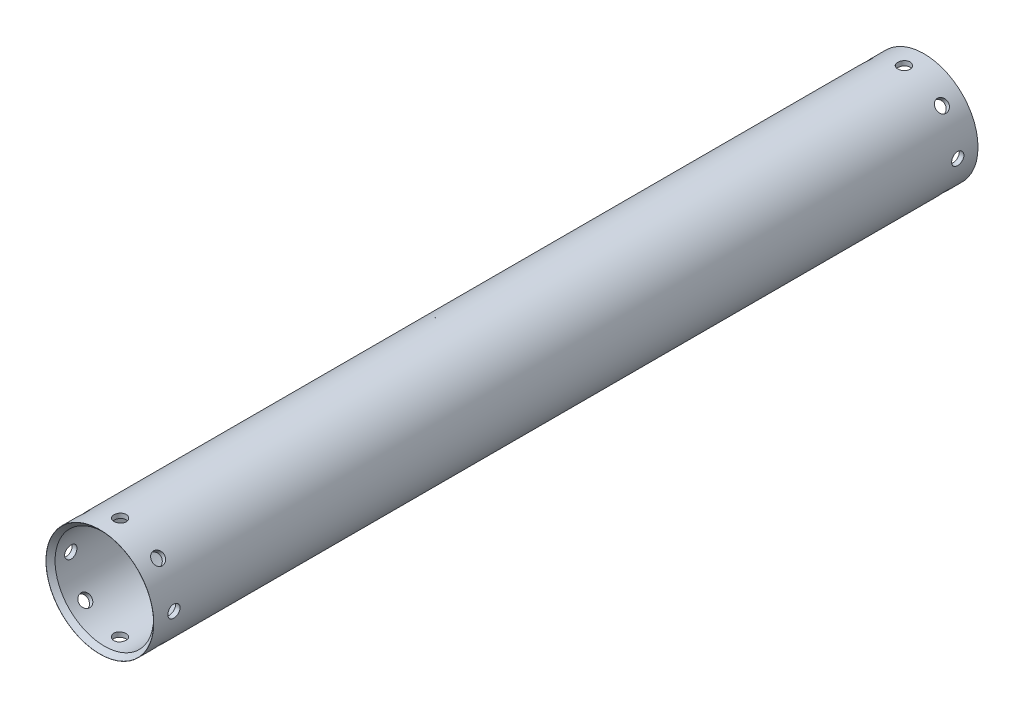
from build123d import *

# Parameters (mm, degrees)
SKETCH1_R               = 38.275
BOSS_EXTRUDE1_DEPTH     = 585
SKETCH2_R               = 34.975
CUT_EXTRUDE1_DEPTH      = 585
CUT_EXTRUDE2_DEPTH      = 588.49889468
CUT_EXTRUDE2_DEPTH_BACK = 588.49889468
SKETCH6_R               = 4.35
CUT_EXTRUDE3_DEPTH      = 588.498894792
CUT_EXTRUDE3_DEPTH_BACK = 588.498894792
SKETCH7_R               = 4.35
CUT_EXTRUDE4_DEPTH      = 588.498894792
CUT_EXTRUDE4_DEPTH_BACK = 588.498894792
SKETCH8_R               = 4.35
CUT_EXTRUDE5_DEPTH      = 588.498894792
CUT_EXTRUDE5_DEPTH_BACK = 588.498894792
SKETCH9_R               = 4.35
CUT_EXTRUDE6_DEPTH      = 593.25290528
CUT_EXTRUDE6_DEPTH_BACK = 593.25290528
SKETCH10_R              = 4.35
CUT_EXTRUDE7_DEPTH      = 593.25290528
CUT_EXTRUDE7_DEPTH_BACK = 593.25290528
SKETCH11_R              = 4.35
CUT_EXTRUDE8_DEPTH      = 585
CUT_EXTRUDE8_DEPTH_BACK = 585
SKETCH12_R              = 4.35
CUT_EXTRUDE9_DEPTH      = 585
CUT_EXTRUDE9_DEPTH_BACK = 585
SKETCH13_R              = 4.35
CHAMFER1_SIZE           = 3.2
CHAMFER2_SIZE           = 3.2


with BuildPart() as part:
    # Sketch1 → Boss-Extrude1 (new body)
    with BuildSketch(Plane.XY):
        Circle(SKETCH1_R)
    extrude(amount=BOSS_EXTRUDE1_DEPTH)

    # Sketch2 → Cut-Extrude1 (cut)
    with BuildSketch(Plane.XY.offset(585)):
        Circle(SKETCH2_R)
    extrude(amount=-CUT_EXTRUDE1_DEPTH, mode=Mode.SUBTRACT)

    # Sketch6 → Cut-Extrude2 (cut, two sides: drawn at the far end of the back side and taken through both)
    with BuildSketch(Plane(origin=(0, 0, 0), x_dir=(1, 0, 0), z_dir=(0, 1, 0)).offset(-CUT_EXTRUDE2_DEPTH_BACK)):
        with Locations(Location((0, -570.65, 0), (0, 0, 270))):
            Circle(SKETCH6_R)
    extrude(amount=CUT_EXTRUDE2_DEPTH + CUT_EXTRUDE2_DEPTH_BACK, mode=Mode.SUBTRACT)

    # Sketch7 → Cut-Extrude3 (cut, two sides: drawn at the far end of the back side and taken through both)
    with BuildSketch(Plane(origin=(0, 0, 0), x_dir=(0, 0, -1), z_dir=(1, 0, 0)).offset(-CUT_EXTRUDE3_DEPTH_BACK)):
        with Locations((-570.65, 0)):
            Circle(SKETCH7_R)
    extrude(amount=CUT_EXTRUDE3_DEPTH + CUT_EXTRUDE3_DEPTH_BACK, mode=Mode.SUBTRACT)

    # Sketch8 → Cut-Extrude4 (cut, two sides: drawn at the far end of the back side and taken through both)
    with BuildSketch(Plane(origin=(0, 0, 0), x_dir=(0, 0, -1), z_dir=(1, 0, 0)).offset(-CUT_EXTRUDE4_DEPTH_BACK)):
        with Locations((-14.35, 0)):
            Circle(SKETCH8_R)
    extrude(amount=CUT_EXTRUDE4_DEPTH + CUT_EXTRUDE4_DEPTH_BACK, mode=Mode.SUBTRACT)

    # Sketch9 → Cut-Extrude5 (cut, two sides: drawn at the far end of the back side and taken through both)
    with BuildSketch(Plane(origin=(0, 0, 0), x_dir=(1, 0, 0), z_dir=(0, 1, 0)).offset(-CUT_EXTRUDE5_DEPTH_BACK)):
        with Locations(Location((0, -14.35, 0), (0, 0, 270))):
            Circle(SKETCH9_R)
    extrude(amount=CUT_EXTRUDE5_DEPTH + CUT_EXTRUDE5_DEPTH_BACK, mode=Mode.SUBTRACT)

    # Sketch10 → Cut-Extrude6 (cut, two sides: drawn at the far end of the back side and taken through both)
    with BuildSketch(Plane(origin=(27.06451205, -27.06451205, 0), x_dir=(0, 0, -1), z_dir=(0.7071067811865464, -0.7071067811865488, 0)).offset(-CUT_EXTRUDE6_DEPTH_BACK)):
        with Locations(Location((-570.65, 0, 0), (0, 0, 270))):
            Circle(SKETCH10_R)
    extrude(amount=CUT_EXTRUDE6_DEPTH + CUT_EXTRUDE6_DEPTH_BACK, mode=Mode.SUBTRACT)

    # Sketch11 → Cut-Extrude7 (cut, two sides: drawn at the far end of the back side and taken through both)
    with BuildSketch(Plane(origin=(27.06451205, -27.06451205, 0), x_dir=(0, 0, -1), z_dir=(0.7071067811865464, -0.7071067811865488, 0)).offset(-CUT_EXTRUDE7_DEPTH_BACK)):
        with Locations(Location((-14.35, 0, 0), (0, 0, 90))):
            Circle(SKETCH11_R)
    extrude(amount=CUT_EXTRUDE7_DEPTH + CUT_EXTRUDE7_DEPTH_BACK, mode=Mode.SUBTRACT)

    # Sketch12 → Cut-Extrude8 (cut, two sides: drawn at the far end of the back side and taken through both)
    with BuildSketch(Plane(origin=(-27.06451205, -27.06451205, 0), x_dir=(0, 0, 1), z_dir=(-0.7071067811865487, -0.7071067811865465, 0)).offset(-CUT_EXTRUDE8_DEPTH_BACK)):
        with Locations(Location((570.65, 0, 0), (0, 0, 90))):
            Circle(SKETCH12_R)
    extrude(amount=CUT_EXTRUDE8_DEPTH + CUT_EXTRUDE8_DEPTH_BACK, mode=Mode.SUBTRACT)

    # Sketch13 → Cut-Extrude9 (cut, two sides: drawn at the far end of the back side and taken through both)
    with BuildSketch(Plane(origin=(-27.06451205, -27.06451205, 0), x_dir=(0, 0, 1), z_dir=(-0.7071067811865487, -0.7071067811865465, 0)).offset(-CUT_EXTRUDE9_DEPTH_BACK)):
        with Locations(Location((14.35, 0, 0), (0, 0, 270))):
            Circle(SKETCH13_R)
    extrude(amount=CUT_EXTRUDE9_DEPTH + CUT_EXTRUDE9_DEPTH_BACK, mode=Mode.SUBTRACT)

    # Chamfer1
    chamfer1_edges = [part.edges().sort_by_distance(p)[0] for p in [
        (-34.975, 0, 585),
    ]]
    chamfer(chamfer1_edges, length=CHAMFER1_SIZE)

    # Chamfer2
    chamfer2_edges = [part.edges().sort_by_distance(p)[0] for p in [
        (-34.975, 0, 0),
    ]]
    chamfer(chamfer2_edges, length=CHAMFER2_SIZE)


solid = part.part
